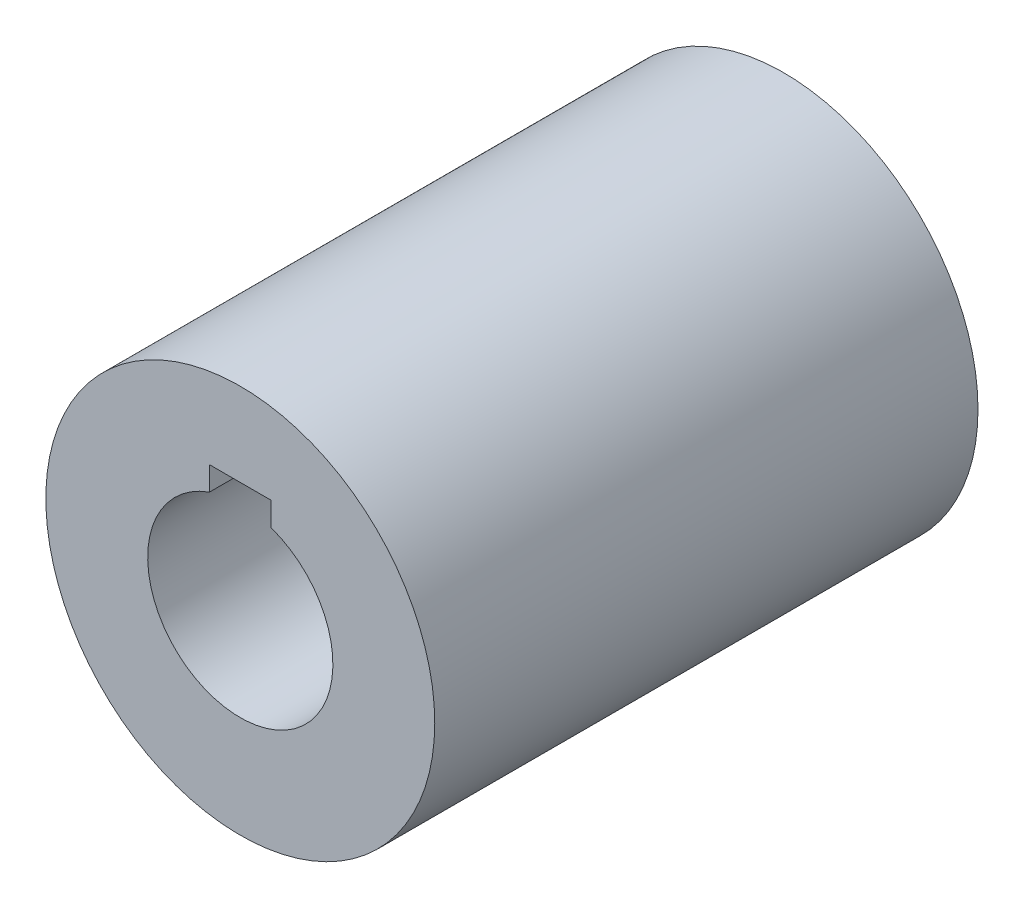
from build123d import *

# Parameters (mm, degrees)
SKETCH1_R           = 31.5
BOSS_EXTRUDE1_DEPTH = 88


with BuildPart() as part:
    # Sketch1 → Boss-Extrude1 (new body)
    with BuildSketch(Plane.XY):
        Circle(SKETCH1_R)
        with BuildLine():
            Line((-5, 18), (5, 18))
            Line((5, 18), (5, 14.142135624))
            ThreePointArc((5, 14.142135624), (0, -15), (-5, 14.142135624))
            Line((-5, 14.142135624), (-5, 18))
        make_face(mode=Mode.SUBTRACT)
    extrude(amount=BOSS_EXTRUDE1_DEPTH)


solid = part.part
